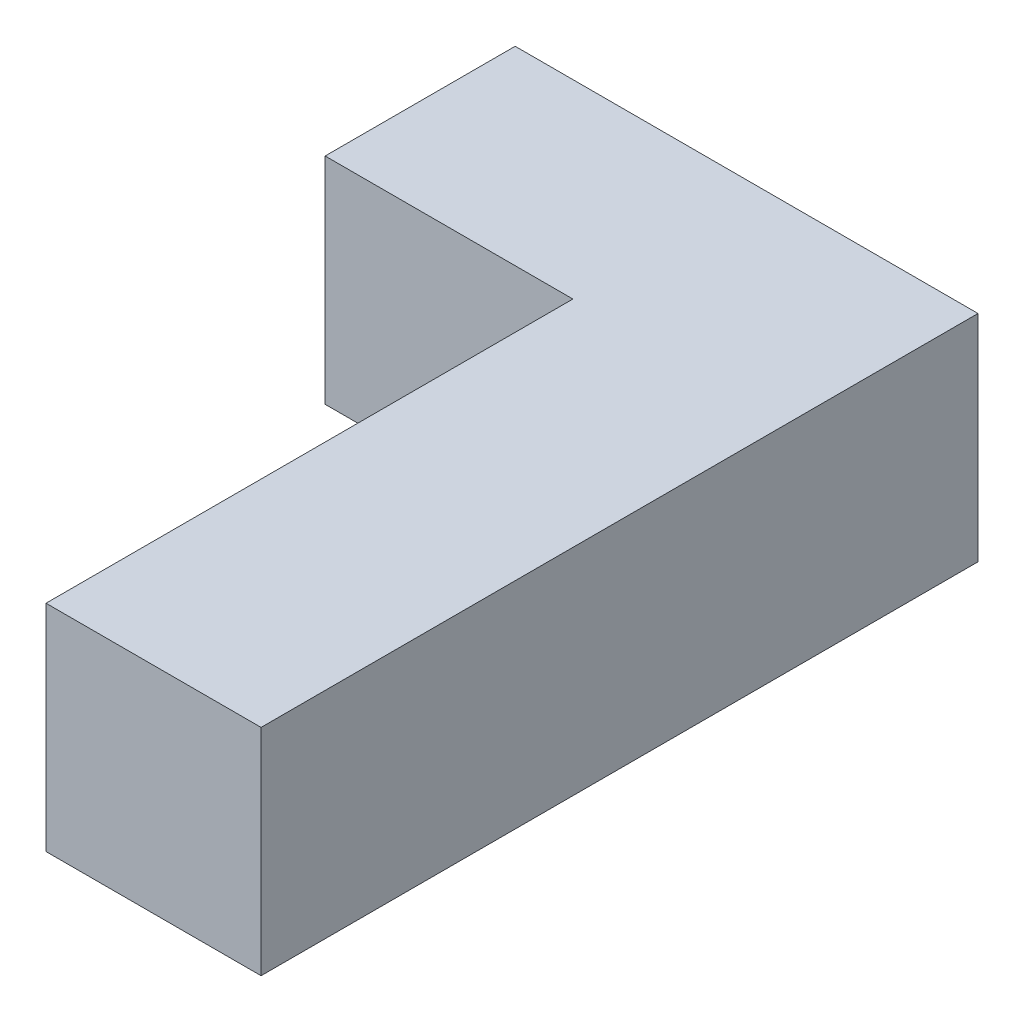
from build123d import *

# Parameters (mm, degrees)
SKETCH1_W           = 50
SKETCH1_H           = 50
BOSS_EXTRUDE1_DEPTH = 15
CUT_EXTRUDE1_DEPTH  = 73.284161474


with BuildPart() as part:
    # Sketch1 → Boss-Extrude1 (new body)
    with BuildSketch(Plane(origin=(0, 0, 0), x_dir=(1, 0, 0), z_dir=(0, 1, 0))):
        with Locations((25, 25)):
            Rectangle(SKETCH1_W, SKETCH1_H)
    extrude(amount=BOSS_EXTRUDE1_DEPTH)

    # Sketch2 → Cut-Extrude1 (cut, through all)
    with BuildSketch(Plane(origin=(0, 15, 0), x_dir=(1, 0, 0), z_dir=(0, 1, 0))):
        Polygon((17.720843029, 51.746489104), (17.720843029, 36.746489104), (35, 36.746489104), (35, -6.576637999), (-8.682924796, -6.576637999), (-8.682924796, 51.746489104), align=None)
    extrude(amount=-CUT_EXTRUDE1_DEPTH, mode=Mode.SUBTRACT)


solid = part.part
